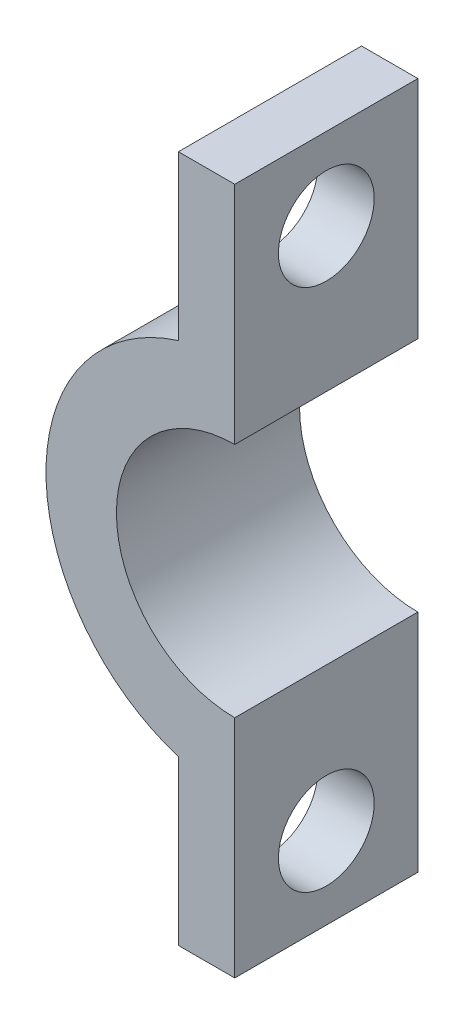
from build123d import *

# Parameters (mm, degrees)
ESTRUSIONE_ESTRUSIONE1_DEPTH = 6.5
SCHIZZO2_R                   = 1.7
TAGLIO_ESTRUSIONE1_DEPTH     = 6.5


with BuildPart() as part:
    # Schizzo1 → Estrusione-Estrusione1 (new body)
    with BuildSketch(Plane.XY):
        with BuildLine():
            Line((0, 4.2), (0, 12.2))
            Line((0, 12.2), (-2, 12.2))
            Line((-2, 12.2), (-2, 6.394528911))
            ThreePointArc((-2, 6.394528911), (-6.7, 0), (-2, -6.394528911))
            Line((-2, -6.394528911), (-2, -12.2))
            Line((-2, -12.2), (0, -12.2))
            Line((0, -12.2), (0, -4.2))
            ThreePointArc((0, -4.2), (-4.2, 0), (0, 4.2))
        make_face()
    extrude(amount=ESTRUSIONE_ESTRUSIONE1_DEPTH)

    # Schizzo2 → Taglio-Estrusione1 (cut)
    with BuildSketch(Plane.ZY.offset(2)):
        with Locations(Location((3.25, 9.297264456, 0), (0, 0, 270))):
            Circle(SCHIZZO2_R)
    taglio_estrusione1 = extrude(amount=-TAGLIO_ESTRUSIONE1_DEPTH, mode=Mode.SUBTRACT)

    # Specchia1: Taglio-Estrusione1 across plane
    add(taglio_estrusione1.mirror(Plane.ZX), mode=Mode.SUBTRACT)


solid = part.part
